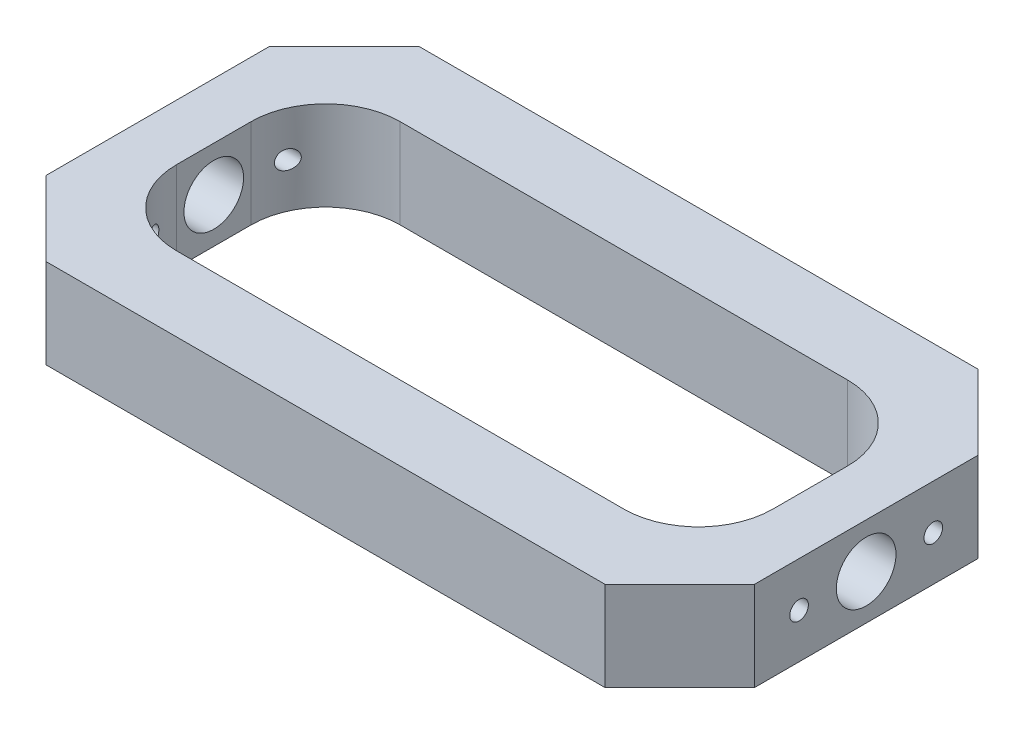
from build123d import *

# Parameters (mm, degrees)
SKETCH2_W                  = 95
SKETCH2_H                  = 50
SKETCH2_W_2                = 80
SKETCH2_H_2                = 30
BOSS_EXTRUDE1_DEPTH        = 6
CUT_EXTRUDE1_DEPTH         = 55.011572834
CUT_EXTRUDE1_DEPTH_BACK    = 55.011572834
SKETCH4_R                  = 4
FILLET1_R                  = 10
M3X0_5_TAPPED_HOLE1_REACH  = 100.417
M3X0_5_TAPPED_HOLE1_BORE_R = 1.25
CHAMFER1_SIZE              = 10


with BuildPart() as part:
    # Sketch2 → Boss-Extrude1 (new, symmetric)
    with BuildSketch(Plane(origin=(0, 0, 0), x_dir=(1, 0, 0), z_dir=(0, 1, 0))):
        Rectangle(SKETCH2_W, SKETCH2_H)
        Rectangle(SKETCH2_W_2, SKETCH2_H_2, mode=Mode.SUBTRACT)
    extrude(amount=BOSS_EXTRUDE1_DEPTH, both=True)

    # Sketch4 → Cut-Extrude1 (cut, two sides: drawn at the far end of the back side and taken through both)
    with BuildSketch(Plane(origin=(0, 0, 0), x_dir=(0, 0, -1), z_dir=(1, 0, 0)).offset(-CUT_EXTRUDE1_DEPTH_BACK)):
        Circle(SKETCH4_R)
    extrude(amount=CUT_EXTRUDE1_DEPTH + CUT_EXTRUDE1_DEPTH_BACK, mode=Mode.SUBTRACT)

    # Fillet1
    fillet1_edges = [part.edges().sort_by_distance(p)[0] for p in [
        (40, 0, 15),
        (40, 0, -15),
        (-40, 0, -15),
        (-40, 0, 15),
    ]]
    fillet(fillet1_edges, radius=FILLET1_R)

    # M3x0.5 Tapped Hole1 bore → M3x0.5 Tapped Hole1 (cut, up to next)
    with BuildSketch(Plane.ZY.offset(47.5), mode=Mode.PRIVATE) as m3x0_5_tapped_hole1_sk1:
        with Locations((-9, 0)):
            Circle(M3X0_5_TAPPED_HOLE1_BORE_R)
    m3x0_5_tapped_hole1_tool1 = extrude(m3x0_5_tapped_hole1_sk1.sketch, amount=-M3X0_5_TAPPED_HOLE1_REACH, mode=Mode.PRIVATE) & part.part
    # M3x0.5 Tapped Hole1 bore → M3x0.5 Tapped Hole1 (cut, up to next)
    with BuildSketch(Plane.ZY.offset(47.5), mode=Mode.PRIVATE) as m3x0_5_tapped_hole1_sk2:
        with Locations((9, 0)):
            Circle(M3X0_5_TAPPED_HOLE1_BORE_R)
    m3x0_5_tapped_hole1_tool2 = extrude(m3x0_5_tapped_hole1_sk2.sketch, amount=-M3X0_5_TAPPED_HOLE1_REACH, mode=Mode.PRIVATE) & part.part
    m3x0_5_tapped_hole1_1 = m3x0_5_tapped_hole1_tool1.solids().sort_by_distance((-47.5, 0, -9))[0]
    add(m3x0_5_tapped_hole1_1, mode=Mode.SUBTRACT)
    m3x0_5_tapped_hole1_2 = m3x0_5_tapped_hole1_tool2.solids().sort_by_distance((-47.5, 0, 9))[0]
    add(m3x0_5_tapped_hole1_2, mode=Mode.SUBTRACT)
    m3x0_5_tapped_hole1 = m3x0_5_tapped_hole1_1 + m3x0_5_tapped_hole1_2  # M3x0.5 Tapped Hole1 as one shape, for the pattern or mirror that repeats it

    # Mirror1: M3x0.5 Tapped Hole1 across plane
    add(m3x0_5_tapped_hole1.mirror(Plane(origin=(0, 0, 0), x_dir=(0, 0, 1), z_dir=(1, 0, 0))), mode=Mode.SUBTRACT)

    # Hole Thread4: M3x0.5 Tapped Hole1 across Right Plane
    add(m3x0_5_tapped_hole1.mirror(Plane(origin=(0, 0, 0), x_dir=(0, 0, -1), z_dir=(1, 0, 0))), mode=Mode.SUBTRACT)

    # Chamfer1
    chamfer1_edges = [part.edges().sort_by_distance(p)[0] for p in [
        (47.5, 0, 25),
        (-47.5, 0, 25),
        (-47.5, 0, -25),
        (47.5, 0, -25),
    ]]
    chamfer(chamfer1_edges, length=CHAMFER1_SIZE)


solid = part.part
